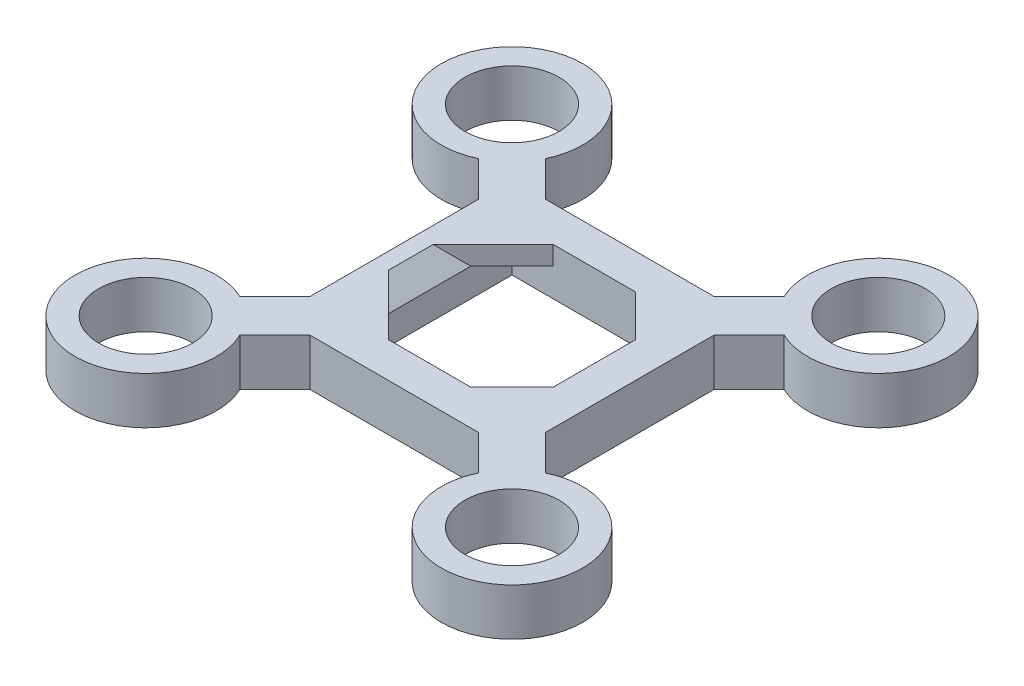
from build123d import *

# Parameters (mm, degrees)
SKETCH1_R           = 0.5
SKETCH1_W           = 5
SKETCH1_H           = 5
SKETCH1_W_2         = 3.5
SKETCH1_H_2         = 3.5
BOSS_EXTRUDE3_DEPTH = 1
BOSS_EXTRUDE4_DEPTH = 0.4
CHAMFER1_SIZE       = 0.4
SKETCH5_R           = 1.5
BOSS_EXTRUDE5_DEPTH = 1
SKETCH6_R           = 1
CUT_EXTRUDE1_DEPTH  = 1


with BuildPart() as part:
    # Sketch1 → Boss-Extrude3 (new body)
    # profile 1 of 9: a face of its own
    with BuildSketch(Plane(origin=(0, 0, 0), x_dir=(1, 0, 0), z_dir=(0, 1, 0))):
        with Locations((-4.596194078, 4.596194078)):
            Circle(SKETCH1_R)
    # profile 2 of 9: a face of its own
    with BuildSketch(Plane(origin=(0, 0, 0), x_dir=(1, 0, 0), z_dir=(0, 1, 0))):
        with BuildLine():
            Line((-4.949747468, 4.242640687), (-2.5, 1.792893219))
            Line((-2.5, 1.792893219), (-2.5, 2.5))
            Line((-2.5, 2.5), (-1.792893219, 2.5))
            Line((-1.792893219, 2.5), (-4.242640687, 4.949747468))
            ThreePointArc((-4.242640687, 4.949747468), (-4.134254311, 4.787535794), (-4.096194078, 4.596194078))
            ThreePointArc((-4.096194078, 4.596194078), (-4.404852362, 4.134254311), (-4.949747468, 4.242640687))
        make_face()
    # profile 3 of 9: a face of its own
    with BuildSketch(Plane(origin=(0, 0, 0), x_dir=(1, 0, 0), z_dir=(0, 1, 0))):
        Rectangle(SKETCH1_W, SKETCH1_H)
        Rectangle(SKETCH1_W_2, SKETCH1_H_2, mode=Mode.SUBTRACT)
    # profile 4 of 9: a face of its own
    with BuildSketch(Plane(origin=(0, 0, 0), x_dir=(1, 0, 0), z_dir=(0, 1, 0))):
        with BuildLine():
            Line((2.5, 2.5), (2.5, 1.792893219))
            Line((2.5, 1.792893219), (4.949747468, 4.242640687))
            ThreePointArc((4.949747468, 4.242640687), (4.242640687, 4.242640687), (4.242640687, 4.949747468))
            Line((4.242640687, 4.949747468), (1.792893219, 2.5))
            Line((1.792893219, 2.5), (2.5, 2.5))
        make_face()
    # profile 5 of 9: a face of its own
    with BuildSketch(Plane(origin=(0, 0, 0), x_dir=(1, 0, 0), z_dir=(0, 1, 0))):
        with Locations((4.596194078, 4.596194078)):
            Circle(SKETCH1_R)
    # profile 6 of 9: a face of its own
    with BuildSketch(Plane(origin=(0, 0, 0), x_dir=(1, 0, 0), z_dir=(0, 1, 0))):
        with Locations((4.596194078, -4.596194078)):
            Circle(SKETCH1_R)
    # profile 7 of 9: a face of its own
    with BuildSketch(Plane(origin=(0, 0, 0), x_dir=(1, 0, 0), z_dir=(0, 1, 0))):
        with BuildLine():
            Line((2.5, -2.5), (1.792893219, -2.5))
            Line((1.792893219, -2.5), (4.242640687, -4.949747468))
            ThreePointArc((4.242640687, -4.949747468), (4.242640687, -4.242640687), (4.949747468, -4.242640687))
            Line((4.949747468, -4.242640687), (2.5, -1.792893219))
            Line((2.5, -1.792893219), (2.5, -2.5))
        make_face()
    # profile 8 of 9: a face of its own
    with BuildSketch(Plane(origin=(0, 0, 0), x_dir=(1, 0, 0), z_dir=(0, 1, 0))):
        with BuildLine():
            Line((-1.792893219, -2.5), (-2.5, -2.5))
            Line((-2.5, -2.5), (-2.5, -1.792893219))
            Line((-2.5, -1.792893219), (-4.949747468, -4.242640687))
            ThreePointArc((-4.949747468, -4.242640687), (-4.404852362, -4.134254311), (-4.096194078, -4.596194078))
            ThreePointArc((-4.096194078, -4.596194078), (-4.134254311, -4.787535794), (-4.242640687, -4.949747468))
            Line((-4.242640687, -4.949747468), (-1.792893219, -2.5))
        make_face()
    # profile 9 of 9: a face of its own
    with BuildSketch(Plane(origin=(0, 0, 0), x_dir=(1, 0, 0), z_dir=(0, 1, 0))):
        with Locations((-4.596194078, -4.596194078)):
            Circle(SKETCH1_R)
    extrude(amount=BOSS_EXTRUDE3_DEPTH)

    # Sketch4 → Boss-Extrude4 (add)
    with BuildSketch(Plane(origin=(0, 1, 0), x_dir=(1, 0, 0), z_dir=(0, 1, 0))):
        Polygon((-1.75, 0.875), (-0.875, 1.75), (-1.75, 1.75), align=None)
        Polygon((1.75, -0.875), (1.75, -1.75), (0.875, -1.75), align=None)
        Polygon((0.875, 1.75), (1.75, 0.875), (1.75, 1.75), align=None)
        Polygon((-0.875, -1.75), (-1.75, -1.75), (-1.75, -0.875), align=None)
    extrude(amount=-BOSS_EXTRUDE4_DEPTH)

    # Chamfer1
    chamfer1_edges = [part.edges().sort_by_distance(p)[0] for p in [
        (-1.75, 1, 0),
    ]]
    chamfer(chamfer1_edges, length=CHAMFER1_SIZE)

    # Sketch5 → Boss-Extrude5 (add)
    with BuildSketch(Plane(origin=(0, 1, 0), x_dir=(1, 0, 0), z_dir=(0, 1, 0))):
        with Locations((-3.889087297, 3.889087297)):
            Circle(SKETCH5_R)
        with Locations((3.889087297, -3.889087297)):
            Circle(SKETCH5_R)
        with Locations((3.889087297, 3.889087297)):
            Circle(SKETCH5_R)
        with Locations((-3.889087297, -3.889087297)):
            Circle(SKETCH5_R)
    extrude(amount=-BOSS_EXTRUDE5_DEPTH)

    # Sketch6 → Cut-Extrude1 (cut)
    with BuildSketch(Plane(origin=(0, 1, 0), x_dir=(1, 0, 0), z_dir=(0, 1, 0))):
        with Locations(Location((-3.889087297, 3.889087297, 0), (0, 0, 270))):
            Circle(SKETCH6_R)
        with Locations(Location((3.889087297, -3.889087297, 0), (0, 0, 90))):
            Circle(SKETCH6_R)
        with Locations(Location((3.889087297, 3.889087297, 0), (0, 0, 270))):
            Circle(SKETCH6_R)
        with Locations(Location((-3.889087297, -3.889087297, 0), (0, 0, 90))):
            Circle(SKETCH6_R)
    extrude(amount=-CUT_EXTRUDE1_DEPTH, mode=Mode.SUBTRACT)


solid = part.part
